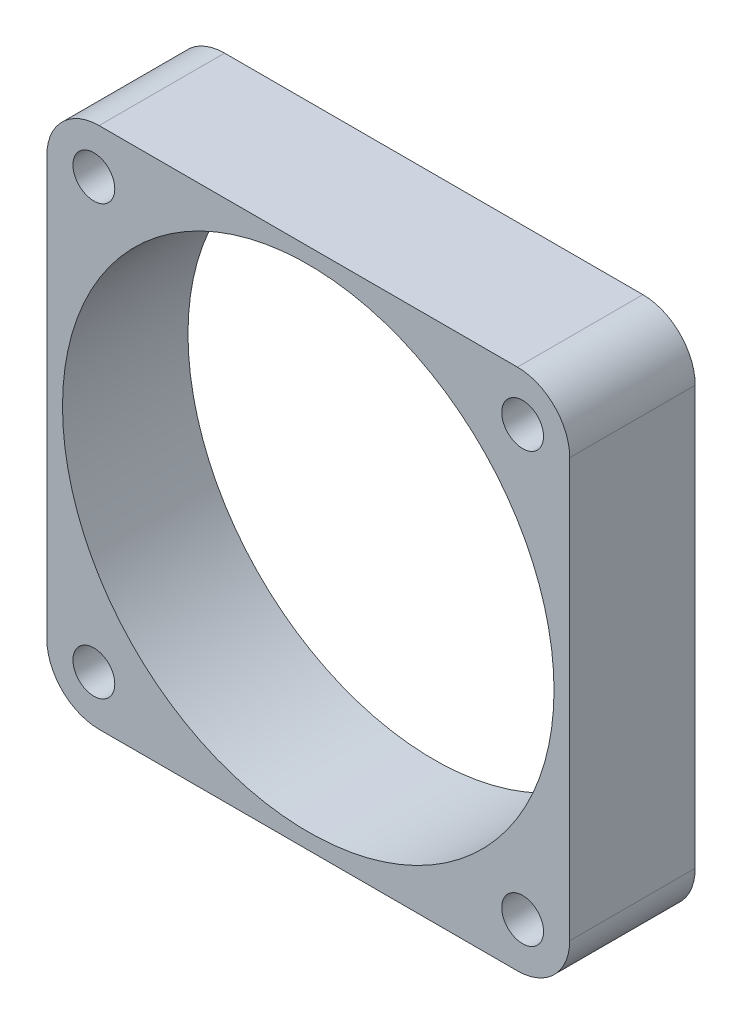
from build123d import *

# Parameters (mm, degrees)
SKETCH_1_W      = 50
SKETCH_1_H      = 50
SKETCH_1_R      = 2
SKETCH_1_R_2    = 23.5
EXTRUDE_1_DEPTH = 12
FILLET_1_R      = 5


with BuildPart() as part:
    # 草图1 → 凸台-拉伸1 (new body)
    with BuildSketch(Plane.XY):
        with Locations((-26.20618851, -18.866504484)):
            Rectangle(SKETCH_1_W, SKETCH_1_H)
        with Locations((-46.70618851, -39.366504484)):
            Circle(SKETCH_1_R, mode=Mode.SUBTRACT)
        with Locations((-5.70618851, -39.366504484)):
            Circle(SKETCH_1_R, mode=Mode.SUBTRACT)
        with Locations((-5.70618851, 1.633495516)):
            Circle(SKETCH_1_R, mode=Mode.SUBTRACT)
        with Locations((-46.70618851, 1.633495516)):
            Circle(SKETCH_1_R, mode=Mode.SUBTRACT)
        with Locations((-26.20618851, -18.866504484)):
            Circle(SKETCH_1_R_2, mode=Mode.SUBTRACT)
    extrude(amount=EXTRUDE_1_DEPTH)

    # 圆角1
    fillet_1_edges = [part.edges().sort_by_distance(p)[0] for p in [
        (-51.20618851, 6.133495516, 6),
        (-1.20618851, 6.133495516, 6),
        (-1.20618851, -43.866504484, 6),
        (-51.20618851, -43.866504484, 6),
    ]]
    fillet(fillet_1_edges, radius=FILLET_1_R)


solid = part.part
